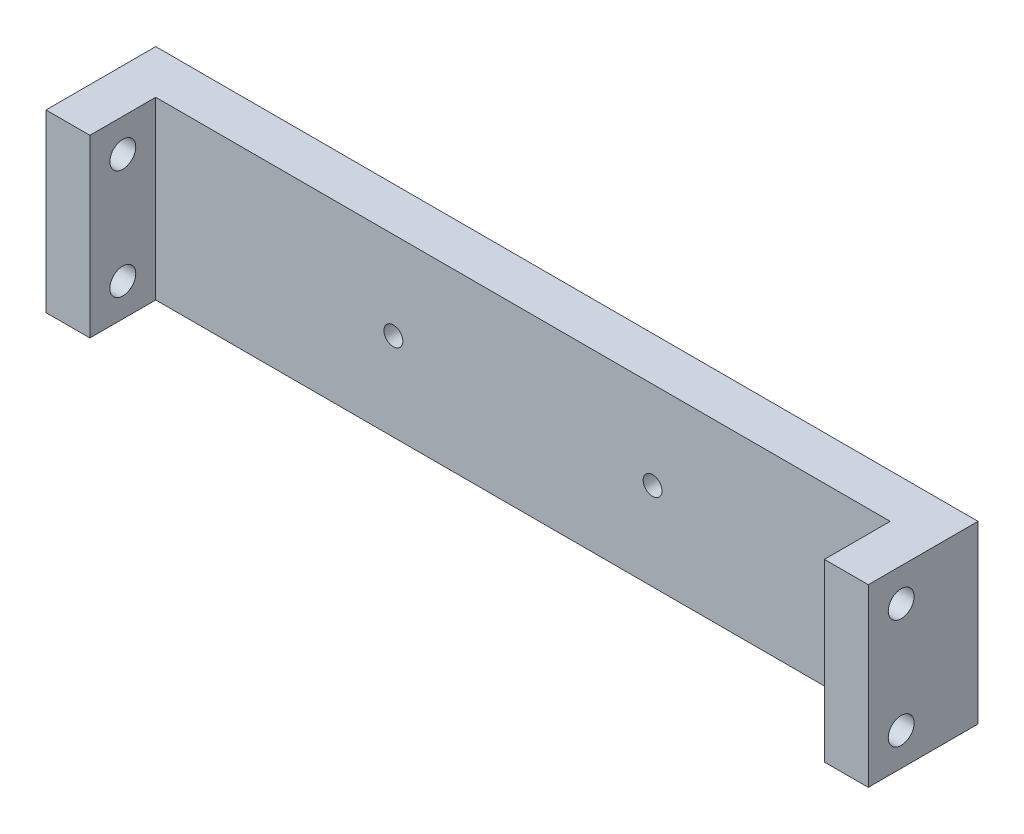
from build123d import *

# Parameters (mm, degrees)
SKETCH1_W               = 85.0138
SKETCH1_H               = 20.32
SKETCH1_R               = 1.0922
BOSS_EXTRUDE1_DEPTH     = 5.08
SKETCH1_3_W             = 5.08
SKETCH1_3_H             = 20.32
BOSS_EXTRUDE2_DEPTH     = 12.7
CUT_EXTRUDE1_DEPTH      = 94.22598993
CUT_EXTRUDE1_DEPTH_BACK = 94.22598993
SKETCH2_R               = 1.5


with BuildPart() as part:
    # Sketch1 → Boss-Extrude1 (new body)
    with BuildSketch(Plane.XY):
        with Locations((47.5869, 10.16)):
            Rectangle(SKETCH1_W, SKETCH1_H)
        with Locations((62.5869, 10.16)):
            Circle(SKETCH1_R, mode=Mode.SUBTRACT)
        with Locations((32.5869, 10.16)):
            Circle(SKETCH1_R, mode=Mode.SUBTRACT)
    extrude(amount=BOSS_EXTRUDE1_DEPTH)

    # Sketch1<3> → Boss-Extrude2 (add)
    with BuildSketch(Plane.XY):
        with Locations((92.6338, 10.16)):
            Rectangle(SKETCH1_3_W, SKETCH1_3_H)
        with Locations((2.54, 10.16)):
            Rectangle(SKETCH1_3_W, SKETCH1_3_H)
    extrude(amount=BOSS_EXTRUDE2_DEPTH)

    # Sketch2 → Cut-Extrude1 (cut, two sides: drawn at the far end of the back side and taken through both)
    with BuildSketch(Plane.ZY.offset(-90.0938).offset(-CUT_EXTRUDE1_DEPTH_BACK)):
        with Locations((8.89, 16.51)):
            Circle(SKETCH2_R)
        with Locations((8.89, 3.81)):
            Circle(SKETCH2_R)
    extrude(amount=CUT_EXTRUDE1_DEPTH + CUT_EXTRUDE1_DEPTH_BACK, mode=Mode.SUBTRACT)


solid = part.part
